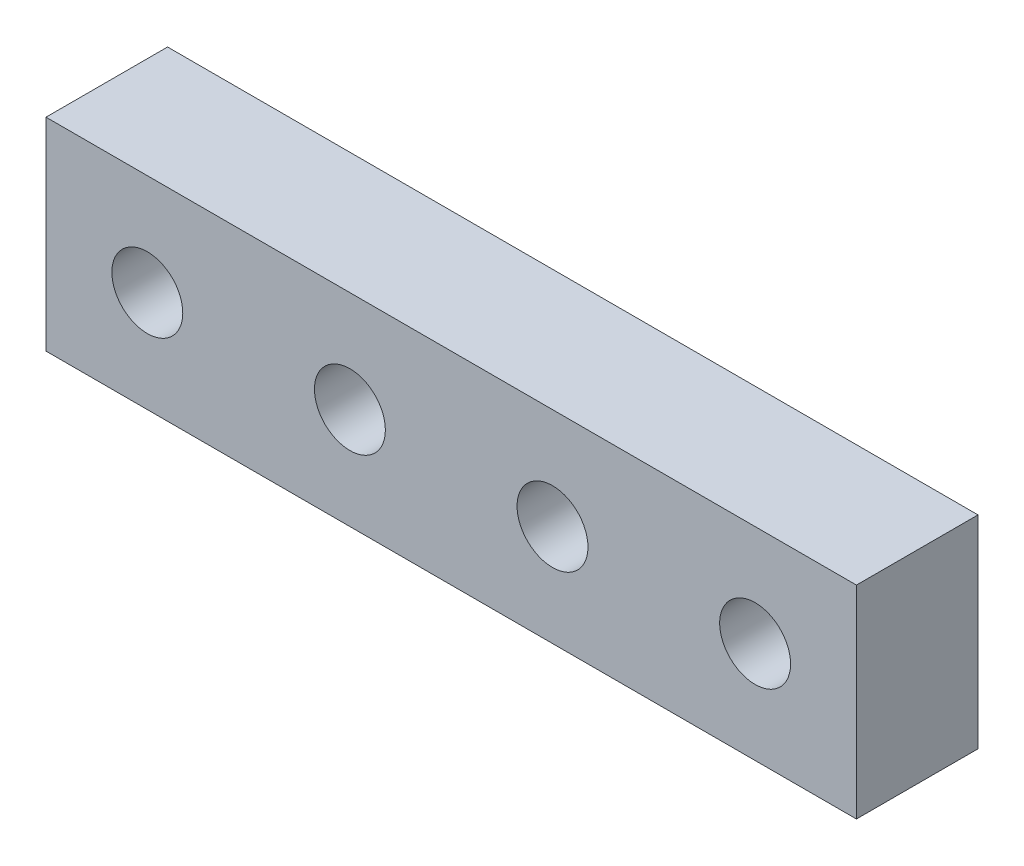
from build123d import *

# Parameters (mm, degrees)
ESQUISSE1_W        = 40
ESQUISSE1_H        = 10
ESQUISSE1_R        = 1.75
BOSS_EXTRU_1_DEPTH = 6


with BuildPart() as part:
    # Esquisse1 → Boss.-Extru.1 (new body)
    with BuildSketch(Plane.XY):
        with Locations((20, 5)):
            Rectangle(ESQUISSE1_W, ESQUISSE1_H)
        with Locations((5, 5)):
            Circle(ESQUISSE1_R, mode=Mode.SUBTRACT)
        with Locations((15, 5)):
            Circle(ESQUISSE1_R, mode=Mode.SUBTRACT)
        with Locations((25, 5)):
            Circle(ESQUISSE1_R, mode=Mode.SUBTRACT)
        with Locations((35, 5)):
            Circle(ESQUISSE1_R, mode=Mode.SUBTRACT)
    extrude(amount=BOSS_EXTRU_1_DEPTH)


solid = part.part
